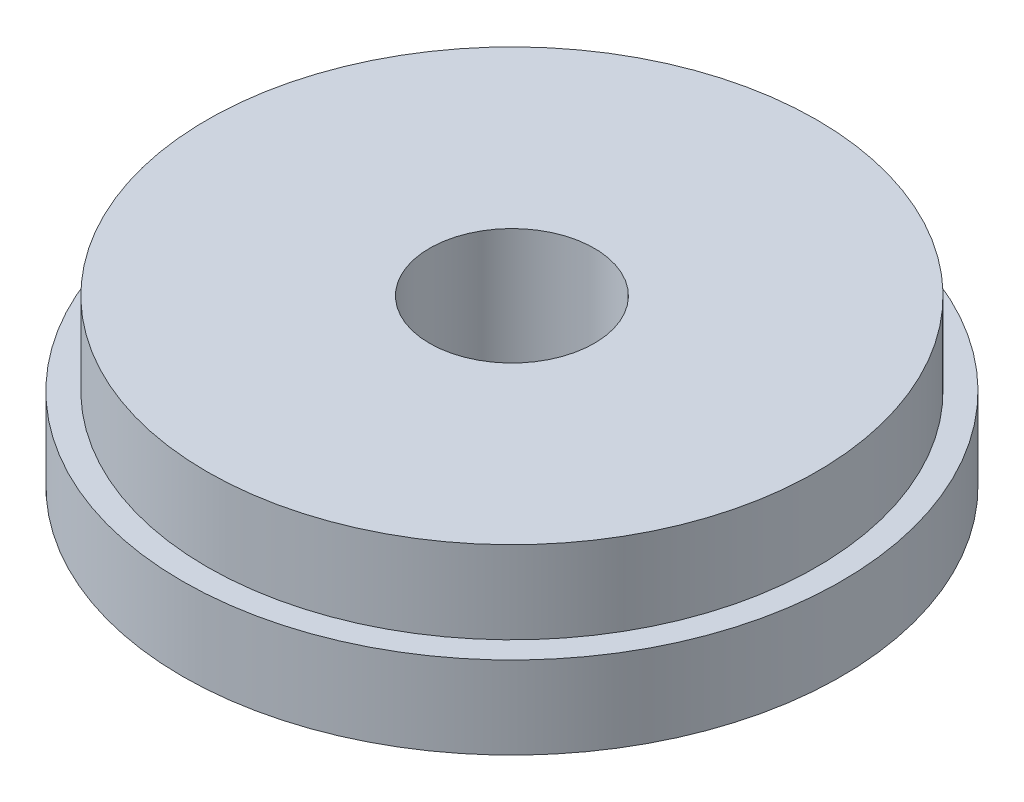
from build123d import *

# Parameters (mm, degrees)
SKETCH1_R           = 20
BOSS_EXTRUDE1_DEPTH = 5
SKETCH2_R           = 18.5
BOSS_EXTRUDE2_DEPTH = 5
SKETCH3_R           = 5
CUT_EXTRUDE1_DEPTH  = 31


with BuildPart() as part:
    # Sketch1 → Boss-Extrude1 (new body)
    with BuildSketch(Plane(origin=(0, 0, 0), x_dir=(1, 0, 0), z_dir=(0, 1, 0))):
        with Locations(Location((0, 0, 0), (0, 0, 270))):
            Circle(SKETCH1_R)
    extrude(amount=BOSS_EXTRUDE1_DEPTH)

    # Sketch2 → Boss-Extrude2 (add)
    with BuildSketch(Plane(origin=(0, 5, 0), x_dir=(1, 0, 0), z_dir=(0, 1, 0))):
        with Locations(Location((0, 0, 0), (0, 0, 270))):
            Circle(SKETCH2_R)
    extrude(amount=BOSS_EXTRUDE2_DEPTH)

    # Sketch3 → Cut-Extrude1 (cut, through all)
    with BuildSketch(Plane(origin=(0, 10, 0), x_dir=(1, 0, 0), z_dir=(0, 1, 0))):
        with Locations(Location((0, 0, 0), (0, 0, 270))):
            Circle(SKETCH3_R)
    extrude(amount=-CUT_EXTRUDE1_DEPTH, mode=Mode.SUBTRACT)


solid = part.part
